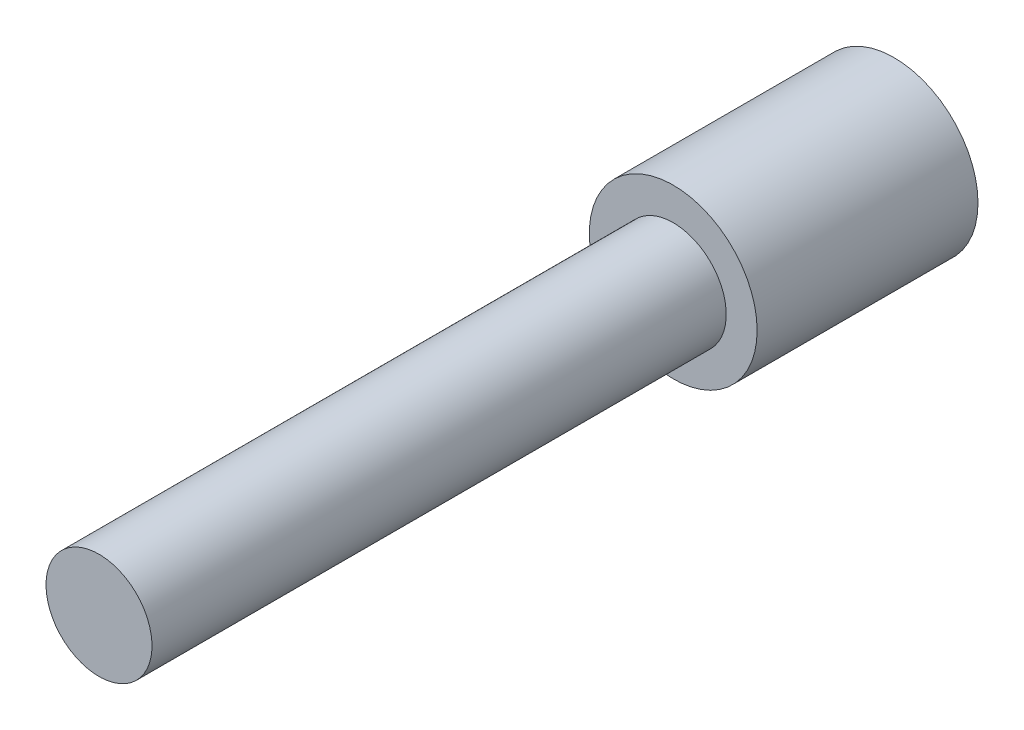
from build123d import *

# Parameters (mm, degrees)
SKETCH1_R           = 6
BOSS_EXTRUDE1_DEPTH = 90
SKETCH2_W           = 25
SKETCH2_H           = 3.681667676
SKETCH3_R           = 7.5
CUT_EXTRUDE1_DEPTH  = 20


with BuildPart() as part:
    # Sketch1 → Boss-Extrude1 (new body)
    with BuildSketch(Plane.XY):
        with Locations(Location((0, 0, 0), (0, 0, 180))):
            Circle(SKETCH1_R)
    extrude(amount=BOSS_EXTRUDE1_DEPTH)

    # Sketch2 → Revolve1 (revolve)
    with BuildSketch(Plane(origin=(0, 0, 0), x_dir=(0, 0, -1), z_dir=(1, 0, 0)), mode=Mode.PRIVATE) as revolve1_sk:
        with Locations((-12.5, 7.840833838)):
            Rectangle(SKETCH2_W, SKETCH2_H)
    revolve(revolve1_sk.sketch.rotate(Axis((0, 0.181667676, 35.200849853), (0, 0, -1)), 90), axis=Axis((0, 0.181667676, 35.200849853), (0, 0, -1)))

    # Sketch3 → Cut-Extrude1 (cut)
    with BuildSketch(Plane(origin=(0, 0, 0), x_dir=(-1, 0, 0), z_dir=(0, 0, -1))):
        Circle(SKETCH3_R)
    extrude(amount=-CUT_EXTRUDE1_DEPTH, mode=Mode.SUBTRACT)


solid = part.part
